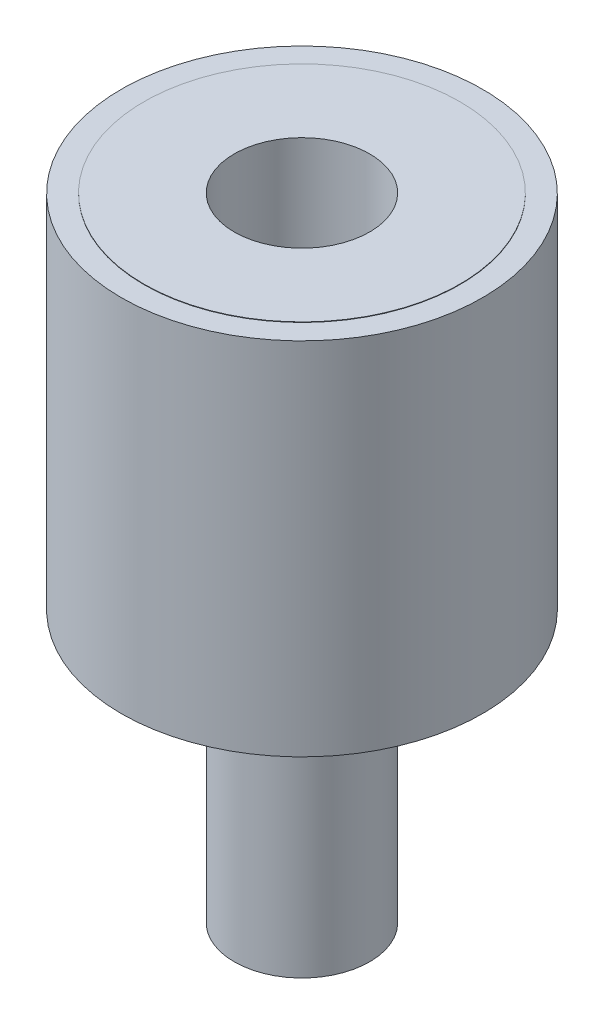
from build123d import *


with BuildPart() as part:
    # Sketch1 → Revolve1 (revolve)
    with BuildSketch(Plane.XY, mode=Mode.PRIVATE) as revolve1_sk:
        Polygon((0, -5.5), (-1.5, -5.5), (-1.5, 0.5), (-3.5, 0.5), (-3.5, 0.51), (-4, 0.51), (-4, 8.49), (-3.5, 8.49), (-3.5, 8.5), (-1.5, 8.5), (-1.5, 5.5), (0, 5.5), align=None)
    revolve(revolve1_sk.sketch.rotate(Axis((0, 5.5, 0), (0, -1, 0)), 270), axis=Axis((0, 5.5, 0), (0, -1, 0)))


solid = part.part
